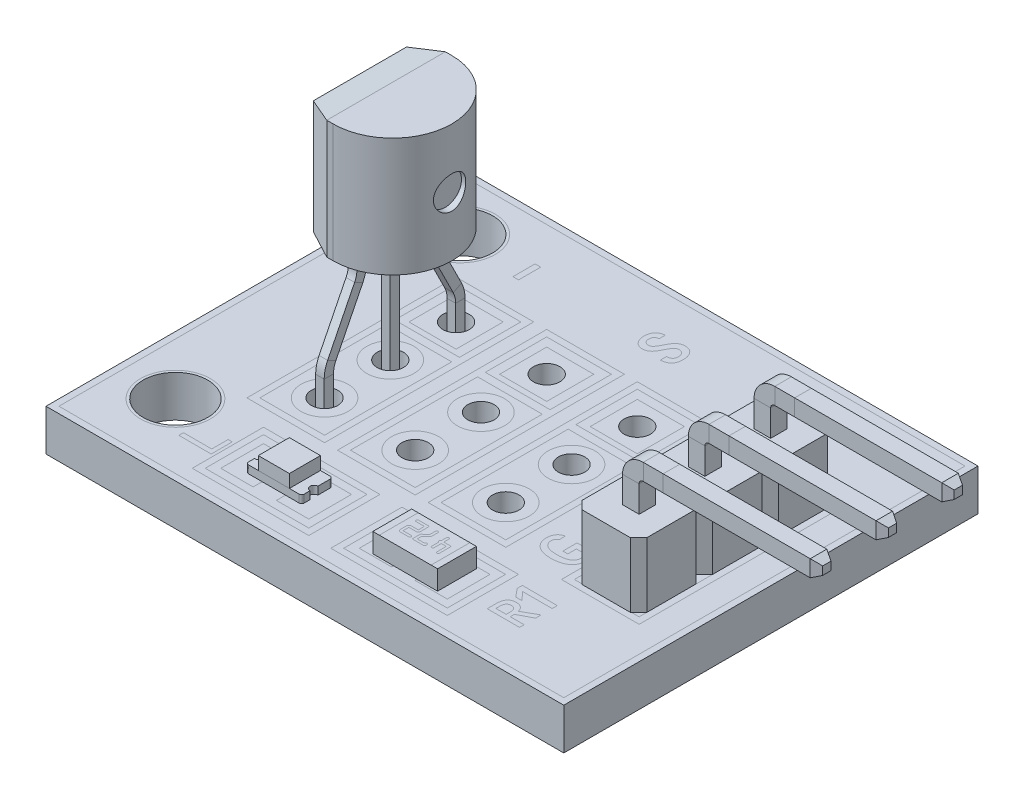
from build123d import *

# Parameters (mm, degrees)
SKETCH2_W                     = 20
SKETCH2_H                     = 16
SKETCH2_R                     = 1.25
SKETCH2_R_2                   = 0.51
BOSS_EXTRUDE1_DEPTH           = 1.6
SKETCH6_W                     = 2.5
SKETCH6_H                     = 1.5
BOSS_EXTRUDE2_DEPTH           = 0.75
BOSS_EXTRUDE3_DEPTH           = 0.3
SKETCH9_W                     = 1.2
SKETCH9_H                     = 1.2
BOSS_EXTRUDE4_DEPTH           = 0.5
BOSS_EXTRUDE5_DEPTH           = 2.5
SKETCH12_W                    = 0.64
SKETCH12_H                    = 0.64
BOSS_EXTRUDE6_DEPTH           = 2.68
SKETCH13_W                    = 0.64
SKETCH13_H                    = 0.64
BOSS_EXTRUDE7_DEPTH           = 0.32
BOSS_EXTRUDE7_DRAFT           = 26.7
BOSS_EXTRUDE7_PROFILE_2_DEPTH = 0.32
BOSS_EXTRUDE7_PROFILE_2_DRAFT = 26.7
BOSS_EXTRUDE7_PROFILE_3_DEPTH = 0.32
BOSS_EXTRUDE7_PROFILE_3_DRAFT = 26.7
SKETCH14_W                    = 0.64
SKETCH14_H                    = 0.64
SKETCH15_W                    = 0.64
SKETCH15_H                    = 0.64
BOSS_EXTRUDE8_DEPTH           = 0.32
BOSS_EXTRUDE8_DRAFT           = 26.7
BOSS_EXTRUDE8_PROFILE_2_DEPTH = 0.32
BOSS_EXTRUDE8_PROFILE_2_DRAFT = 26.7
BOSS_EXTRUDE8_PROFILE_3_DEPTH = 0.32
BOSS_EXTRUDE8_PROFILE_3_DRAFT = 26.7
BOSS_EXTRUDE9_DEPTH           = 4.58
SKETCH22_R                    = 0.625
CUT_EXTRUDE3_DEPTH            = 0.25
SKETCH19_W                    = 0.33
SKETCH19_H                    = 0.36
BOSS_EXTRUDE11_DEPTH          = 7
SKETCH23_W                    = 0.33
SKETCH23_H                    = 0.36


with BuildPart() as part:
    # Sketch2 → Boss-Extrude1 (new body)
    with BuildSketch(Plane(origin=(0, 0, 0), x_dir=(1, 0, 0), z_dir=(0, 1, 0))):
        Rectangle(SKETCH2_W, SKETCH2_H)
        with Locations(Location((-7.75, -5.25, 0), (0, 0, 270))):
            Circle(SKETCH2_R, mode=Mode.SUBTRACT)
        with Locations(Location((-7.75, 5.75, 0), (0, 0, 270))):
            Circle(SKETCH2_R, mode=Mode.SUBTRACT)
        with Locations(Location((2.1, 0.2, 0), (0, 0, 270))):
            Circle(SKETCH2_R_2, mode=Mode.SUBTRACT)
        with Locations(Location((2.1, 2.74, 0), (0, 0, 270))):
            Circle(SKETCH2_R_2, mode=Mode.SUBTRACT)
        with Locations(Location((2.1, -2.34, 0), (0, 0, 270))):
            Circle(SKETCH2_R_2, mode=Mode.SUBTRACT)
        with Locations(Location((-1.4, -2.34, 0), (0, 0, 270))):
            Circle(SKETCH2_R_2, mode=Mode.SUBTRACT)
        with Locations(Location((-1.4, 0.2, 0), (0, 0, 270))):
            Circle(SKETCH2_R_2, mode=Mode.SUBTRACT)
        with Locations(Location((-1.4, 2.74, 0), (0, 0, 270))):
            Circle(SKETCH2_R_2, mode=Mode.SUBTRACT)
        with Locations(Location((-4.9, -2.34, 0), (0, 0, 270))):
            Circle(SKETCH2_R_2, mode=Mode.SUBTRACT)
        with Locations(Location((-4.9, 0.2, 0), (0, 0, 270))):
            Circle(SKETCH2_R_2, mode=Mode.SUBTRACT)
        with Locations(Location((-4.9, 2.74, 0), (0, 0, 270))):
            Circle(SKETCH2_R_2, mode=Mode.SUBTRACT)
        with Locations(Location((7.25, 0.2, 0), (0, 0, 270))):
            Circle(SKETCH2_R_2, mode=Mode.SUBTRACT)
        with Locations(Location((7.25, 2.74, 0), (0, 0, 270))):
            Circle(SKETCH2_R_2, mode=Mode.SUBTRACT)
        with Locations(Location((7.25, -2.34, 0), (0, 0, 270))):
            Circle(SKETCH2_R_2, mode=Mode.SUBTRACT)
    extrude(amount=BOSS_EXTRUDE1_DEPTH)

    # Sketch6 → Boss-Extrude2 (add)
    with BuildSketch(Plane(origin=(0, 1.6, 0), x_dir=(1, 0, 0), z_dir=(0, 1, 0))):
        with Locations((2.5, -5.875)):
            Rectangle(SKETCH6_W, SKETCH6_H)
    extrude(amount=BOSS_EXTRUDE2_DEPTH)

    # Sketch8 → Boss-Extrude3 (add)
    with BuildSketch(Plane(origin=(0, 1.6, 0), x_dir=(1, 0, 0), z_dir=(0, 1, 0))):
        with BuildLine():
            Line((-1.875, -6.349717549), (-3.825, -6.349717549))
            ThreePointArc((-3.825, -6.349717549), (-3.895710678, -6.320428227), (-3.925, -6.249717549))
            Line((-3.925, -6.249717549), (-3.925, -6.025))
            ThreePointArc((-3.925, -6.025), (-3.775, -5.875), (-3.925, -5.725))
            Line((-3.925, -5.725), (-3.925, -5.249717549))
            ThreePointArc((-3.925, -5.249717549), (-3.895710678, -5.17900687), (-3.825, -5.149717549))
            Line((-3.825, -5.149717549), (-1.875, -5.149717549))
            ThreePointArc((-1.875, -5.149717549), (-1.804289322, -5.17900687), (-1.775, -5.249717549))
            Line((-1.775, -5.249717549), (-1.775, -5.725))
            ThreePointArc((-1.775, -5.725), (-1.925, -5.875), (-1.775, -6.025))
            Line((-1.775, -6.025), (-1.775, -6.249717549))
            ThreePointArc((-1.775, -6.249717549), (-1.804289322, -6.320428227), (-1.875, -6.349717549))
        make_face()
    extrude(amount=BOSS_EXTRUDE3_DEPTH)

    # Sketch9 → Boss-Extrude4 (add)
    with BuildSketch(Plane(origin=(0, 1.9, 0), x_dir=(1, 0, 0), z_dir=(0, 1, 0))):
        with Locations((-2.85, -5.749717549)):
            Rectangle(SKETCH9_W, SKETCH9_H)
    extrude(amount=BOSS_EXTRUDE4_DEPTH)

    # Sketch11 → Boss-Extrude5 (add)
    with BuildSketch(Plane(origin=(0, 1.6, 0), x_dir=(1, 0, 0), z_dir=(0, 1, 0))):
        Polygon((8.5, -3.29), (8.18, -3.61), (6.32, -3.61), (6, -3.29), (6, -1.39), (6.32, -1.07), (8.18, -1.07), (8.5, -1.39), align=None)
        Polygon((8.5, -0.75), (8.18, -1.07), (6.32, -1.07), (6, -0.75), (6, 1.15), (6.32, 1.47), (8.18, 1.47), (8.5, 1.15), align=None)
        Polygon((8.18, 4.01), (6.32, 4.01), (6, 3.69), (6, 1.79), (6.32, 1.47), (8.18, 1.47), (8.5, 1.79), (8.5, 3.69), align=None)
    extrude(amount=BOSS_EXTRUDE5_DEPTH)

    # Sketch12 → Boss-Extrude6 (add)
    with BuildSketch(Plane.XZ.offset(-1.6)):
        with Locations((7.25, -0.2)):
            Rectangle(SKETCH12_W, SKETCH12_H)
        with Locations((7.25, -2.74)):
            Rectangle(SKETCH12_W, SKETCH12_H)
        with Locations((7.25, 2.34)):
            Rectangle(SKETCH12_W, SKETCH12_H)
    extrude(amount=BOSS_EXTRUDE6_DEPTH)


with BuildPart() as boss_extrude7_tool:
    # Sketch13 → Boss-Extrude7 (with draft: the straight prism first)
    with BuildSketch(Plane.XZ.offset(1.08)):
        with Locations((7.25, -2.74)):
            Rectangle(SKETCH13_W, SKETCH13_H)
    extrude(amount=BOSS_EXTRUDE7_DEPTH)
    # Boss-Extrude7: the draft: its side faces are tilted about the plane it starts from
    boss_extrude7_sides = [boss_extrude7_tool.faces().sort_by_distance(p)[0] for p in [
        (7.57, -1.24, -2.74),
        (7.25, -1.24, -2.42),
        (6.93, -1.24, -2.74),
        (7.25, -1.24, -3.06),
    ]]
    draft(boss_extrude7_sides, Plane.XZ.offset(1.08), BOSS_EXTRUDE7_DRAFT)


with BuildPart() as part_1:
    add(part.part)

    # Boss-Extrude7: add boss_extrude7_tool
    add(boss_extrude7_tool.part)


with BuildPart() as boss_extrude7_profile_2_tool:
    # Sketch13 → Boss-Extrude7 profile 2 (with draft: the straight prism first)
    with BuildSketch(Plane.XZ.offset(1.08)):
        with Locations((7.25, 2.34)):
            Rectangle(SKETCH13_W, SKETCH13_H)
    extrude(amount=BOSS_EXTRUDE7_PROFILE_2_DEPTH)
    # Boss-Extrude7 profile 2: the draft: its side faces are tilted about the plane it starts from
    boss_extrude7_profile_2_sides = [boss_extrude7_profile_2_tool.faces().sort_by_distance(p)[0] for p in [
        (7.25, -1.24, 2.02),
        (7.57, -1.24, 2.34),
        (7.25, -1.24, 2.66),
        (6.93, -1.24, 2.34),
    ]]
    draft(boss_extrude7_profile_2_sides, Plane.XZ.offset(1.08), BOSS_EXTRUDE7_PROFILE_2_DRAFT)


with BuildPart() as part_2:
    add(part_1.part)

    # Boss-Extrude7 profile 2: add boss_extrude7_profile_2_tool
    add(boss_extrude7_profile_2_tool.part)


with BuildPart() as boss_extrude7_profile_3_tool:
    # Sketch13 → Boss-Extrude7 profile 3 (with draft: the straight prism first)
    with BuildSketch(Plane.XZ.offset(1.08)):
        with Locations((7.25, -0.2)):
            Rectangle(SKETCH13_W, SKETCH13_H)
    extrude(amount=BOSS_EXTRUDE7_PROFILE_3_DEPTH)
    # Boss-Extrude7 profile 3: the draft: its side faces are tilted about the plane it starts from
    boss_extrude7_profile_3_sides = [boss_extrude7_profile_3_tool.faces().sort_by_distance(p)[0] for p in [
        (7.25, -1.24, -0.52),
        (7.57, -1.24, -0.2),
        (7.25, -1.24, 0.12),
        (6.93, -1.24, -0.2),
    ]]
    draft(boss_extrude7_profile_3_sides, Plane.XZ.offset(1.08), BOSS_EXTRUDE7_PROFILE_3_DRAFT)


with BuildPart() as part_3:
    add(part_2.part)

    # Boss-Extrude7 profile 3: add boss_extrude7_profile_3_tool
    add(boss_extrude7_profile_3_tool.part)

    # Sweep1: sweep along a curve in space
    with BuildLine() as sweep1_path:
        Line((7.25, 4.1, -2.74), (7.25, 5.12, -2.74))
        ThreePointArc((7.25, 5.12, -2.74), (7.390588745, 5.459411255, -2.74), (7.73, 5.6, -2.74))
        Line((7.73, 5.6, -2.74), (8.5, 5.6, -2.74))
        Line((8.5, 5.6, -2.74), (14.18, 5.6, -2.74))
    # Sketch14 → Sweep1 (sweep)
    with BuildSketch(Plane(origin=(0, 4.1, 0), x_dir=(1, 0, 0), z_dir=(0, 1, 0))):
        with Locations((7.25, -2.34)):
            Rectangle(SKETCH14_W, SKETCH14_H)
        with Locations((7.25, 2.74)):
            Rectangle(SKETCH14_W, SKETCH14_H)
        with Locations((7.25, 0.2)):
            Rectangle(SKETCH14_W, SKETCH14_H)
    sweep(path=sweep1_path.line)


with BuildPart() as boss_extrude8_tool:
    # Sketch15 → Boss-Extrude8 (with draft: the straight prism first)
    with BuildSketch(Plane(origin=(14.18, 0, 0), x_dir=(0, 0, -1), z_dir=(1, 0, 0))):
        with Locations((-2.34, 5.6)):
            Rectangle(SKETCH15_W, SKETCH15_H)
    extrude(amount=BOSS_EXTRUDE8_DEPTH)
    # Boss-Extrude8: the draft: its side faces are tilted about the plane it starts from
    boss_extrude8_sides = [boss_extrude8_tool.faces().sort_by_distance(p)[0] for p in [
        (14.34, 5.6, 2.66),
        (14.34, 5.28, 2.34),
        (14.34, 5.6, 2.02),
        (14.34, 5.92, 2.34),
    ]]
    draft(boss_extrude8_sides, Plane(origin=(14.18, 0, 0), x_dir=(0, 0, -1), z_dir=(1, 0, 0)), BOSS_EXTRUDE8_DRAFT)


with BuildPart() as part_4:
    add(part_3.part)

    # Boss-Extrude8: add boss_extrude8_tool
    add(boss_extrude8_tool.part)


with BuildPart() as boss_extrude8_profile_2_tool:
    # Sketch15 → Boss-Extrude8 profile 2 (with draft: the straight prism first)
    with BuildSketch(Plane(origin=(14.18, 0, 0), x_dir=(0, 0, -1), z_dir=(1, 0, 0))):
        with Locations((0.2, 5.6)):
            Rectangle(SKETCH15_W, SKETCH15_H)
    extrude(amount=BOSS_EXTRUDE8_PROFILE_2_DEPTH)
    # Boss-Extrude8 profile 2: the draft: its side faces are tilted about the plane it starts from
    boss_extrude8_profile_2_sides = [boss_extrude8_profile_2_tool.faces().sort_by_distance(p)[0] for p in [
        (14.34, 5.6, 0.12),
        (14.34, 5.28, -0.2),
        (14.34, 5.6, -0.52),
        (14.34, 5.92, -0.2),
    ]]
    draft(boss_extrude8_profile_2_sides, Plane(origin=(14.18, 0, 0), x_dir=(0, 0, -1), z_dir=(1, 0, 0)), BOSS_EXTRUDE8_PROFILE_2_DRAFT)


with BuildPart() as part_5:
    add(part_4.part)

    # Boss-Extrude8 profile 2: add boss_extrude8_profile_2_tool
    add(boss_extrude8_profile_2_tool.part)


with BuildPart() as boss_extrude8_profile_3_tool:
    # Sketch15 → Boss-Extrude8 profile 3 (with draft: the straight prism first)
    with BuildSketch(Plane(origin=(14.18, 0, 0), x_dir=(0, 0, -1), z_dir=(1, 0, 0))):
        with Locations((2.74, 5.6)):
            Rectangle(SKETCH15_W, SKETCH15_H)
    extrude(amount=BOSS_EXTRUDE8_PROFILE_3_DEPTH)
    # Boss-Extrude8 profile 3: the draft: its side faces are tilted about the plane it starts from
    boss_extrude8_profile_3_sides = [boss_extrude8_profile_3_tool.faces().sort_by_distance(p)[0] for p in [
        (14.34, 5.92, -2.74),
        (14.34, 5.6, -2.42),
        (14.34, 5.28, -2.74),
        (14.34, 5.6, -3.06),
    ]]
    draft(boss_extrude8_profile_3_sides, Plane(origin=(14.18, 0, 0), x_dir=(0, 0, -1), z_dir=(1, 0, 0)), BOSS_EXTRUDE8_PROFILE_3_DRAFT)


with BuildPart() as part_6:
    add(part_5.part)

    # Boss-Extrude8 profile 3: add boss_extrude8_profile_3_tool
    add(boss_extrude8_profile_3_tool.part)


with BuildPart() as body_2:
    # Sketch16 → Boss-Extrude9 (new body)
    with BuildSketch(Plane(origin=(0, 6.1, 0), x_dir=(1, 0, 0), z_dir=(0, 1, 0))):
        with BuildLine():
            Line((-4.815, -2.09), (-5.065, -2.09))
            Line((-5.065, -2.09), (-5.065, 2.49))
            Line((-5.065, 2.49), (-4.815, 2.49))
            ThreePointArc((-4.815, 2.49), (-2.525, 0.2), (-4.815, -2.09))
        make_face()
    extrude(amount=BOSS_EXTRUDE9_DEPTH)

    # Sketch17 → section 1 of loft1
    with BuildSketch(Plane(origin=(-6.075, 0, 0), x_dir=(0, 0, -1), z_dir=(1, 0, 0)), mode=Mode.PRIVATE) as loft1_s1:
        with BuildLine():
            Line((2, 10.58), (-1.6, 10.58))
            Line((-1.6, 10.58), (-1.6, 6.2))
            Line((-1.6, 6.2), (2, 6.2))
            Line((2, 6.2), (2, 10.58))
        make_face()
    # loft from a face of the part (loft1)
    loft([body_2.faces().sort_by_distance((-5.065, 8.39, -0.2))[0], loft1_s1.sketch])

    # Sketch22 → Cut-Extrude3 (cut)
    with BuildSketch(Plane.ZY.offset(2.525)):
        with Locations(Location((-0.2, 8.39, 0), (0, 0, 180))):
            Circle(SKETCH22_R)
    extrude(amount=CUT_EXTRUDE3_DEPTH, mode=Mode.SUBTRACT)

    # Sketch19 → Boss-Extrude11 (add)
    with BuildSketch(Plane.XZ.offset(-6.1)):
        with Locations((-4.9, -0.2)):
            Rectangle(SKETCH19_W, SKETCH19_H)
    extrude(amount=BOSS_EXTRUDE11_DEPTH)

    # Sweep2: sweep along a curve in space
    with BuildLine() as sweep2_path:
        Line((-5.065, 6.1, 1.07), (-5.065, 5.45, 1.07))
        ThreePointArc((-5.065, 5.45, 1.07), (-5.065, 5.202180587, 1.098815649), (-5.065, 4.967584753, 1.183725001))
        Line((-5.065, 4.967584753, 1.183725001), (-5.065, 2.879250494, 2.226274999))
        ThreePointArc((-5.065, 2.879250494, 2.226274999), (-5.065, 2.64465466, 2.311184351), (-5.065, 2.396835247, 2.34))
        Line((-5.065, 2.396835247, 2.34), (-5.065, -0.603164753, 2.34))
    # Sketch23 → Sweep2 (sweep)
    with BuildSketch(Plane.XZ.offset(-6.1)):
        with Locations((-4.9, 1.07)):
            Rectangle(SKETCH23_W, SKETCH23_H)
    sweep2 = sweep(path=sweep2_path.line)

    # Mirror1: Sweep2 across plane
    add(sweep2.mirror(Plane(origin=(0, 0, -0.2), x_dir=(1, 0, 0), z_dir=(0, 0, -1))))


solid = Compound([part_6.part, body_2.part])
